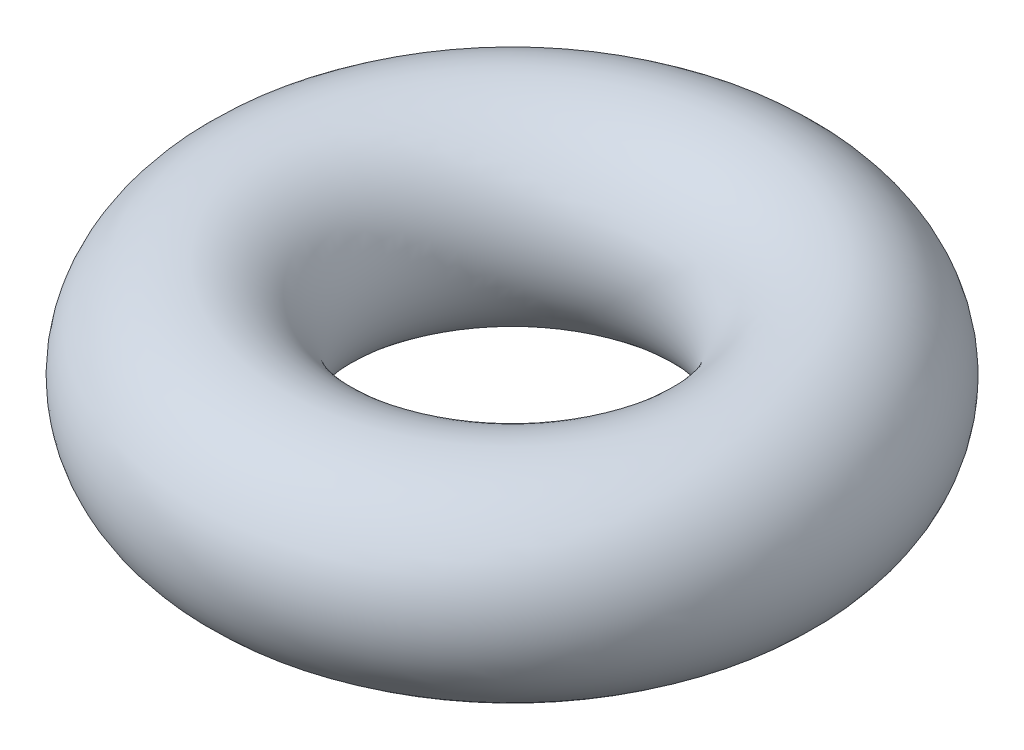
from build123d import *

# Parameters (mm, degrees)
MAINBODYS_R = 0.6


with BuildPart() as part:
    # MainBodyS → MAIN BODY (revolve)
    with BuildSketch(Plane.XY):
        with Locations((1.4, 0)):
            Circle(MAINBODYS_R)
    revolve(axis=Axis((0, 0, 0), (0, -1, 0)))


solid = part.part
